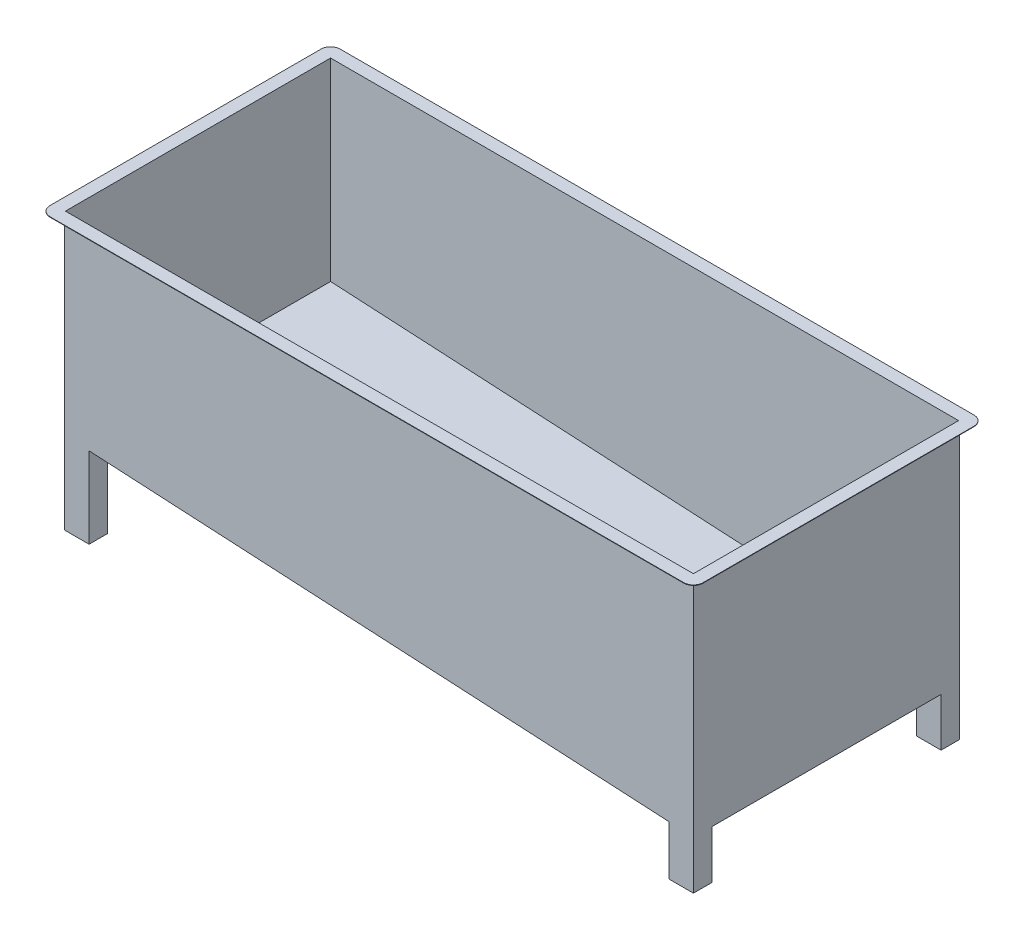
from build123d import *

# Parameters (mm, degrees)
CROQUIS2_W              = 2600
CROQUIS2_H              = 1100
SALIENTE_EXTRUIR1_DEPTH = 1.89
CROQUIS3_W              = 2600
CROQUIS3_H              = 1100
CROQUIS3_W_2            = 2596.22
CROQUIS3_H_2            = 1096.22
SALIENTE_EXTRUIR2_DEPTH = 940
CROQUIS4_W              = 2700
CROQUIS4_H              = 1200
CROQUIS4_W_2            = 2600
CROQUIS4_H_2            = 1100
SALIENTE_EXTRUIR3_DEPTH = 1.89
REDONDEO1_R             = 40
CORTAR_EXTRUIR2_REACH   = 2010.023
SALIENTE_EXTRUIR4_DEPTH = 1100
SALIENTE_EXTRUIR5_DEPTH = 76.2
SALIENTE_EXTRUIR6_DEPTH = 76.2
CROQUIS10_R             = 12.7
CORTAR_EXTRUIR3_DEPTH   = 280


with BuildPart() as part:
    # Croquis2 → Saliente-Extruir1 (new body)
    with BuildSketch(Plane(origin=(0, 0, 0), x_dir=(1, 0, 0), z_dir=(0, 1, 0))):
        Rectangle(CROQUIS2_W, CROQUIS2_H)
    extrude(amount=SALIENTE_EXTRUIR1_DEPTH)

    # Croquis3 → Saliente-Extruir2 (add)
    with BuildSketch(Plane(origin=(0, 1.89, 0), x_dir=(1, 0, 0), z_dir=(0, 1, 0))):
        Rectangle(CROQUIS3_W, CROQUIS3_H)
        Rectangle(CROQUIS3_W_2, CROQUIS3_H_2, mode=Mode.SUBTRACT)
    extrude(amount=SALIENTE_EXTRUIR2_DEPTH)

    # Croquis4 → Saliente-Extruir3 (add)
    with BuildSketch(Plane(origin=(0, 941.89, 0), x_dir=(1, 0, 0), z_dir=(0, 1, 0))):
        Rectangle(CROQUIS4_W, CROQUIS4_H)
        Rectangle(CROQUIS4_W_2, CROQUIS4_H_2, mode=Mode.SUBTRACT)
    extrude(amount=-SALIENTE_EXTRUIR3_DEPTH)

    # Redondeo1
    redondeo1_edges = [part.edges().sort_by_distance(p)[0] for p in [
        (-1350, 940.945, -600),
        (1350, 940.945, -600),
        (1350, 940.945, 600),
        (-1350, 940.945, 600),
    ]]
    fillet(redondeo1_edges, radius=REDONDEO1_R)

    # Cortar-Extruir2: up to this face of the body (flat: up to its plane)
    cortar_extruir2_end = Plane(part.part.faces().sort_by_distance((0, 470, 550))[0])
    # Croquis6 → Cortar-Extruir2 (cut, up to the picked face)
    with BuildSketch(Plane(origin=(0, 0, -550), x_dir=(-1, 0, 0), z_dir=(0, 0, -1)), mode=Mode.PRIVATE) as cortar_extruir2_sk1:
        Polygon((-1300, 0), (1300, 140), (1300, 0), align=None)
    cortar_extruir2_tool1 = split(extrude(cortar_extruir2_sk1.sketch, amount=-CORTAR_EXTRUIR2_REACH, mode=Mode.PRIVATE), bisect_by=cortar_extruir2_end, keep=Keep.BOTH, mode=Mode.PRIVATE)
    add(cortar_extruir2_tool1.solids().sort_by(Axis((-433.333333, 46.666667, -550), (0, 0, 1)))[0], mode=Mode.SUBTRACT)

    # Croquis7 → Saliente-Extruir4 (add)
    with BuildSketch(Plane(origin=(0, 0, -550), x_dir=(-1, 0, 0), z_dir=(0, 0, -1))):
        Polygon((-1300, 0), (1300, 140), (1300, 141.892737958), (-1300, 1.892737958), align=None)
    extrude(amount=-SALIENTE_EXTRUIR4_DEPTH)

    # Croquis8 → Saliente-Extruir5 (add)
    with BuildSketch(Plane(origin=(0, 0, -550), x_dir=(-1, 0, 0), z_dir=(0, 0, -1))):
        Polygon((-1300, 0), (-1300, -200), (-1198.4, -200), (-1198.4, 5.470769231), align=None)
        Polygon((1300, 140), (1300, -200), (1198.4, -200), (1198.4, 134.529230769), align=None)
    extrude(amount=-SALIENTE_EXTRUIR5_DEPTH)

    # Croquis9 → Saliente-Extruir6 (add)
    with BuildSketch(Plane.XY.offset(550)):
        Polygon((1300, 0), (1300, -200), (1198.4, -200), (1198.4, 5.470769231), align=None)
        Polygon((-1300, 140), (-1300, -200), (-1198.4, -200), (-1198.4, 134.529230769), align=None)
    extrude(amount=-SALIENTE_EXTRUIR6_DEPTH)

    # Croquis10 → Cortar-Extruir3 (cut)
    with BuildSketch(Plane.XZ.offset(200)):
        with Locations((1250, 0)):
            Circle(CROQUIS10_R)
        with Locations((1250, 300)):
            Circle(CROQUIS10_R)
    extrude(amount=-CORTAR_EXTRUIR3_DEPTH, mode=Mode.SUBTRACT)


solid = part.part
